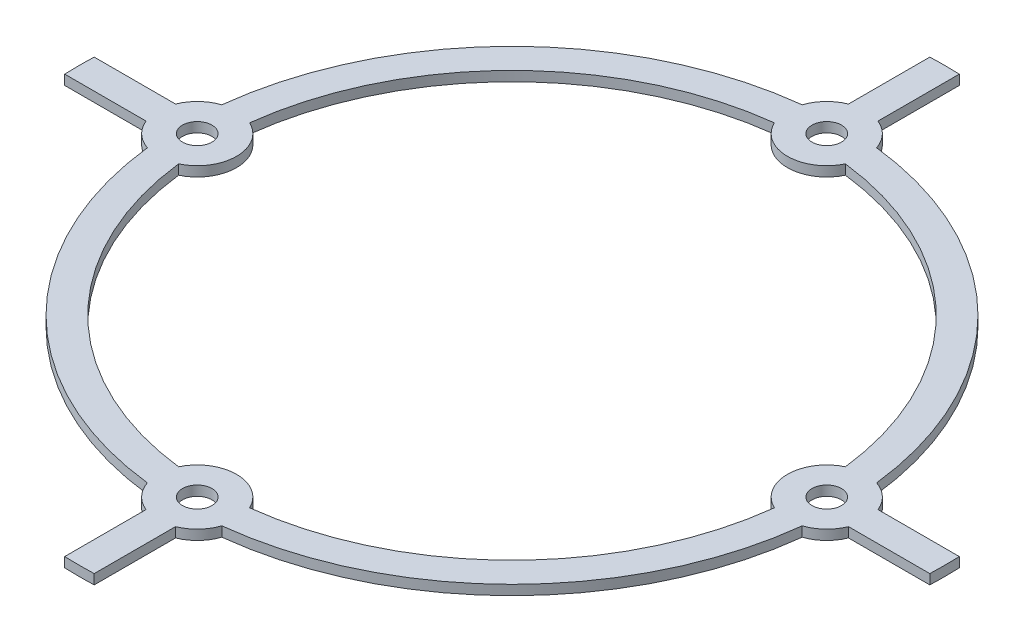
from build123d import *

# Parameters (mm, degrees)
SKETCH1_R                    = 139.7
BOSS_EXTRUDE1_DEPTH          = 3.175
CUT_EXTRUDE1_DEPTH           = 198.591145108
F_3_8_0_375_DIAMETER_HOLE1_D = 9.525
CIRPATTERN2_COUNT            = 4


with BuildPart() as part:
    # Sketch1 → Boss-Extrude1 (new body)
    with BuildSketch(Plane(origin=(0, 0, 0), x_dir=(1, 0, 0), z_dir=(0, 1, 0))):
        with Locations(Location((0, 0, 0), (0, 0, 270))):
            Circle(SKETCH1_R)
    extrude(amount=BOSS_EXTRUDE1_DEPTH)

    # Sketch2 → Cut-Extrude1 (cut, through all)
    with BuildSketch(Plane(origin=(0, 3.175, 0), x_dir=(1, 0, 0), z_dir=(0, 1, 0))):
        with BuildLine():
            Line((139.618797423, 4.7625), (113.373215098, 4.7625))
            ThreePointArc((113.373215098, 4.7625), (110.319292235, 9.233847677), (105.680371094, 12.026660872))
            ThreePointArc((105.680371094, 12.026660872), (75.209645014, 75.209645014), (12.026660872, 105.680371094))
            ThreePointArc((12.026660872, 105.680371094), (9.233847677, 110.319292235), (4.7625, 113.373215098))
            Line((4.7625, 113.373215098), (4.7625, 139.618797423))
            ThreePointArc((4.7625, 139.618797423), (98.782817332, 98.782817332), (139.618797423, 4.7625))
        make_face()
        with BuildLine():
            Line((0, 88.9), (0, 0))
            Line((0, 0), (88.9, 0))
            ThreePointArc((88.9, 0), (90.866016883, 6.787606828), (96.155371094, 11.473709778))
            ThreePointArc((96.155371094, 11.473709778), (68.474452923, 68.474452923), (11.473709778, 96.155371094))
            ThreePointArc((11.473709778, 96.155371094), (6.787606828, 90.866016883), (0, 88.9))
        make_face()
    cut_extrude1 = extrude(amount=-CUT_EXTRUDE1_DEPTH, mode=Mode.SUBTRACT)

    # 3/8 (0.375) Diameter Hole1 (through all)
    with Locations(Plane(origin=(0, 3.175, 0), x_dir=(1, 0, 0), z_dir=(0, 1, 0))):
        with Locations((101.6, 0)):
            f_3_8_0_375_diameter_hole1 = Hole(F_3_8_0_375_DIAMETER_HOLE1_D / 2)

    # CirPattern2: Cut-Extrude1, 3/8 (0.375) Diameter Hole1 ×4 about axis
    cirpattern2_axis = Axis((0, 0, 0), (0, 1, 0))
    add([cut_extrude1.rotate(cirpattern2_axis, i * 360 / CIRPATTERN2_COUNT) for i in range(1, CIRPATTERN2_COUNT)], mode=Mode.SUBTRACT)
    add([f_3_8_0_375_diameter_hole1.rotate(cirpattern2_axis, i * 360 / CIRPATTERN2_COUNT) for i in range(1, CIRPATTERN2_COUNT)], mode=Mode.SUBTRACT)


solid = part.part
